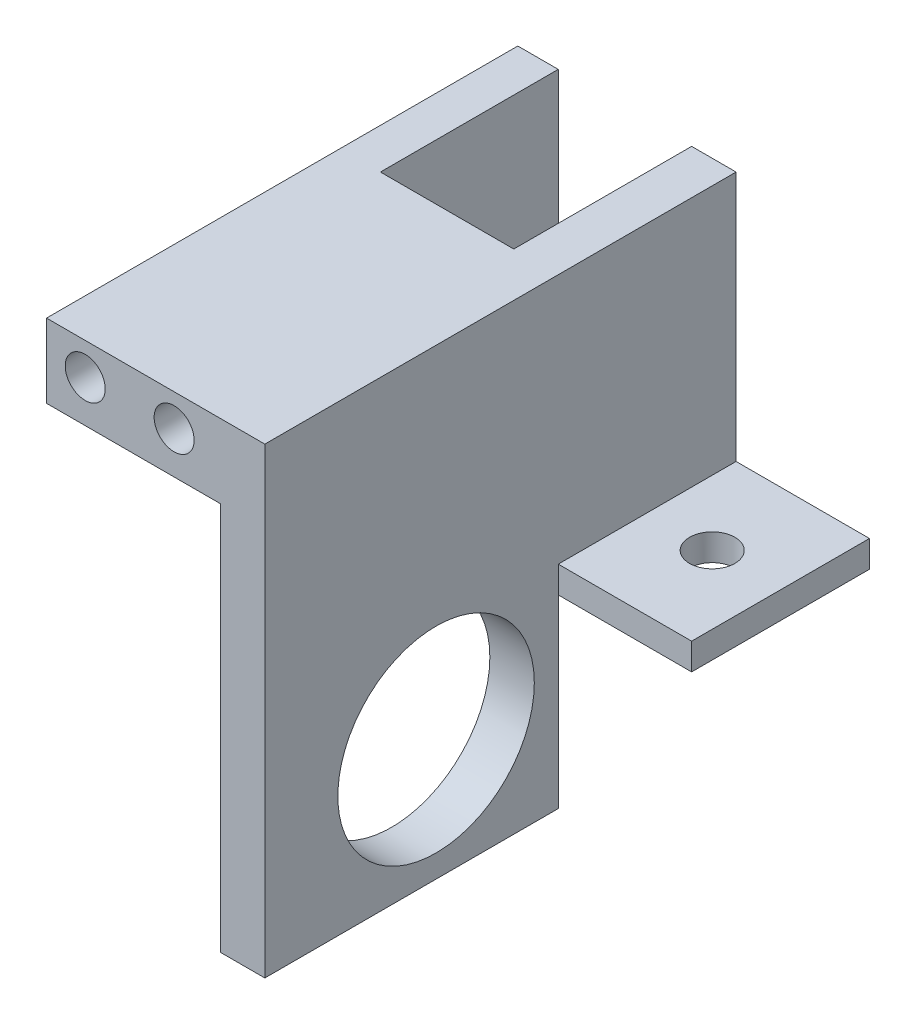
from build123d import *

# Parameters (mm, degrees)
SKETCH_1_W           = 22.333333334
SKETCH_1_H           = 10
EXTRUDE_1_DEPTH      = 30
SKETCH_4_W           = 1.083333334
SKETCH_4_H           = 30
CUT_EXTRUDE_1_DEPTH  = 30
SKETCH_3_R           = 2.25
CUT_EXTRUDE_2_DEPTH  = 15
SKETCH_5_OUTSIDE_W   = 30.87
SKETCH_5_OUTSIDE_H   = 19.62
SKETCH_5_OUTSIDE_W_2 = 18.7
SKETCH_5_OUTSIDE_H_2 = 8.315719237
CUT_EXTRUDE_3_DEPTH  = 30
SKETCH_10_W          = 18.7
SKETCH_10_H          = 8.304405234
EXTRUDE_2_DEPTH      = 18
SKETCH_11_W          = 20
SKETCH_11_H          = 2.687046706
CUT_EXTRUDE_5_DEPTH  = 36.702801011
CUT_EXTRUDE_6_DEPTH  = 32.955789688
SKETCH_13_W          = 18.7
SKETCH_13_H          = 5
EXTRUDE_3_DEPTH      = 5.617358528
SKETCH_15_W          = 18.7
SKETCH_15_H          = 25
CUT_EXTRUDE_7_DEPTH  = 33.535840608
SKETCH_18_W          = 28
SKETCH_18_H          = 8.304405234
EXTRUDE_5_DEPTH      = 0.85
SKETCH_20_W          = 5
SKETCH_20_H          = 28
EXTRUDE_6_DEPTH      = 52
EXTRUDE_7_DEPTH      = 5
SKETCH_22_R          = 10
CUT_EXTRUDE_8_DEPTH  = 63.24117166
EXTRUDE_8_DEPTH      = 20
SKETCH_30_W          = 5
SKETCH_30_H          = 20
CUT_EXTRUDE_10_DEPTH = 20.81
EXTRUDE_9_DEPTH      = 15
EXTRUDE_9_DEPTH_BACK = 20
SKETCH_31_W          = 20
SKETCH_31_H          = 3
SKETCH_32_R          = 2.55
CUT_EXTRUDE_11_DEPTH = 52.125105162
SKETCH_33_W          = 4.55
SKETCH_33_H          = 20
EXTRUDE_10_DEPTH     = 31.19
SKETCH_34_R          = 11.05
CUT_EXTRUDE_12_DEPTH = 10


with BuildPart() as part:
    # 草图1 → 凸台-拉伸1 (new body)
    with BuildSketch(Plane.XY):
        Rectangle(SKETCH_1_W, SKETCH_1_H)
    extrude(amount=EXTRUDE_1_DEPTH)

    # 草图4 → 切除-拉伸1 (cut)
    with BuildSketch(Plane.XZ.offset(5)):
        with Locations((-10.625, 15)):
            Rectangle(SKETCH_4_W, SKETCH_4_H)
    extrude(amount=-CUT_EXTRUDE_1_DEPTH, mode=Mode.SUBTRACT)

    # 草图3 → 切除-拉伸2 (cut)
    with BuildSketch(Plane.XY.offset(30)):
        with Locations((-4.883333333, -0.3)):
            Circle(SKETCH_3_R)
        with Locations((5.116666667, -0.3)):
            Circle(SKETCH_3_R)
    extrude(amount=-CUT_EXTRUDE_2_DEPTH, mode=Mode.SUBTRACT)

    # 草图5 outside → 切除-拉伸3 (cut)
    with BuildSketch(Plane.XY.offset(30)):
        with Locations((0.542, 0)):
            Rectangle(SKETCH_5_OUTSIDE_W, SKETCH_5_OUTSIDE_H)
        with Locations((0.116666667, -0.853454385)):
            Rectangle(SKETCH_5_OUTSIDE_W_2, SKETCH_5_OUTSIDE_H_2, mode=Mode.SUBTRACT)
    extrude(amount=-CUT_EXTRUDE_3_DEPTH, mode=Mode.SUBTRACT)

    # 草图10 → 凸台-拉伸2 (add)
    with BuildSketch(Plane(origin=(0, 0, 0), x_dir=(-1, 0, 0), z_dir=(0, 0, -1))):
        with Locations((-0.116666667, -0.847797383)):
            Rectangle(SKETCH_10_W, SKETCH_10_H)
    extrude(amount=EXTRUDE_2_DEPTH)

    # 草图11 → 切除-拉伸5 (cut, through all)
    with BuildSketch(Plane(origin=(9.466666667, 0, 0), x_dir=(0, 0, -1), z_dir=(1, 0, 0))):
        with Locations((8, -3.656476647)):
            Rectangle(SKETCH_11_W, SKETCH_11_H)
    extrude(amount=-CUT_EXTRUDE_5_DEPTH, mode=Mode.SUBTRACT)

    # 草图12 → 切除-拉伸6 (cut, through all)
    with BuildSketch(Plane.XZ.offset(2.312953294)):
        with BuildLine():
            ThreePointArc((-2.185193673, -12.99813966), (-4.733333333, -10.45), (-7.281472993, -12.99813966))
            Line((-7.281472993, -12.99813966), (-2.185193673, -12.99813966))
        make_face()
        with BuildLine():
            Line((-2.185193673, -12.99813966), (-7.281472993, -12.99813966))
            ThreePointArc((-7.281472993, -12.99813966), (-4.733333333, -15.54627932), (-2.185193673, -12.99813966))
        make_face()
        with BuildLine():
            ThreePointArc((7.514806327, -12.99813966), (4.966666667, -10.45), (2.418527007, -12.99813966))
            Line((2.418527007, -12.99813966), (7.514806327, -12.99813966))
        make_face()
        with BuildLine():
            Line((7.514806327, -12.99813966), (2.418527007, -12.99813966))
            ThreePointArc((2.418527007, -12.99813966), (4.966666667, -15.54627932), (7.514806327, -12.99813966))
        make_face()
    extrude(amount=-CUT_EXTRUDE_6_DEPTH, mode=Mode.SUBTRACT)

    # 草图13 → 凸台-拉伸3 (add)
    with BuildSketch(Plane(origin=(0, 3.304405234, 0), x_dir=(1, 0, 0), z_dir=(0, 1, 0))):
        with Locations((0.116666667, 20.5)):
            Rectangle(SKETCH_13_W, SKETCH_13_H)
    extrude(amount=-EXTRUDE_3_DEPTH)

    # 草图15 → 切除-拉伸7 (cut, through all)
    with BuildSketch(Plane.XZ.offset(5)):
        with Locations((0.116666667, -10.5)):
            Rectangle(SKETCH_15_W, SKETCH_15_H)
    extrude(amount=-CUT_EXTRUDE_7_DEPTH, mode=Mode.SUBTRACT)

    # 草图18 → 凸台-拉伸5 (add)
    with BuildSketch(Plane(origin=(9.466666667, 0, 0), x_dir=(0, 0, -1), z_dir=(1, 0, 0))):
        with Locations((-16, -0.847797383)):
            Rectangle(SKETCH_18_W, SKETCH_18_H)
    extrude(amount=EXTRUDE_5_DEPTH)

    # 草图20 → 凸台-拉伸6 (add)
    with BuildSketch(Plane(origin=(0, 3.304405234, 0), x_dir=(1, 0, 0), z_dir=(0, 1, 0))):
        with Locations((12.816666667, -16)):
            Rectangle(SKETCH_20_W, SKETCH_20_H)
    extrude(amount=-EXTRUDE_6_DEPTH)

    # 草图23 → 凸台-拉伸7 (add)
    with BuildSketch(Plane(origin=(0, 0, 2), x_dir=(-1, 0, 0), z_dir=(0, 0, -1))):
        Polygon((9.233333333, 3.304405234), (-15.316666667, 3.304405234), (-15.316666667, -48.695594766), (-10.316666667, -48.695594766), (-10.316666667, -5), (9.233333333, -5), align=None)
    extrude(amount=EXTRUDE_7_DEPTH)

    # 草图22 → 切除-拉伸8 (cut, through all)
    with BuildSketch(Plane(origin=(15.316666667, 0, 0), x_dir=(0, 0, -1), z_dir=(1, 0, 0))):
        with Locations((-10.741872617, -35.1)):
            Circle(SKETCH_22_R)
    extrude(amount=-CUT_EXTRUDE_8_DEPTH, mode=Mode.SUBTRACT)

    # 草图24 → 凸台-拉伸8 (add)
    with BuildSketch(Plane(origin=(0, 0, -3), x_dir=(-1, 0, 0), z_dir=(0, 0, -1))):
        Polygon((-10.316666667, -5), (-10.316666667, 3.304405234), (-15.316666667, 3.304405234), (-15.316666667, -48.695594766), (-10.316666667, -48.695594766), align=None)
    extrude(amount=EXTRUDE_8_DEPTH)

    # 草图30 → 切除-拉伸10 (cut)
    with BuildSketch(Plane.XZ.offset(48.695594766)):
        with Locations((12.816666667, -13)):
            Rectangle(SKETCH_30_W, SKETCH_30_H)
    extrude(amount=-CUT_EXTRUDE_10_DEPTH, mode=Mode.SUBTRACT)

    # 草图31 → 凸台-拉伸9 (add, two sides: drawn at the far end of the back side and taken through both)
    with BuildSketch(Plane(origin=(15.316666667, 0, 0), x_dir=(0, 0, -1), z_dir=(1, 0, 0)).offset(-EXTRUDE_9_DEPTH_BACK)):
        with Locations((13, -26.385594766)):
            Rectangle(SKETCH_31_W, SKETCH_31_H)
    extrude(amount=EXTRUDE_9_DEPTH + EXTRUDE_9_DEPTH_BACK)

    # 草图32 → 切除-拉伸11 (cut, through all)
    with BuildSketch(Plane(origin=(0, -24.885594766, 0), x_dir=(1, 0, 0), z_dir=(0, 1, 0))):
        with Locations(Location((3.000831302, 13, 0), (0, 0, 270))):
            Circle(SKETCH_32_R)
        with Locations(Location((22.632502032, 13, 0), (0, 0, 270))):
            Circle(SKETCH_32_R)
    extrude(amount=-CUT_EXTRUDE_11_DEPTH, mode=Mode.SUBTRACT)

    # 草图33 → 凸台-拉伸10 (add)
    with BuildSketch(Plane(origin=(0, 3.304405234, 0), x_dir=(1, 0, 0), z_dir=(0, 1, 0))):
        with Locations((-6.958333333, 13)):
            Rectangle(SKETCH_33_W, SKETCH_33_H)
    extrude(amount=-EXTRUDE_10_DEPTH)

    # 草图34 → 切除-拉伸12 (cut)
    with BuildSketch(Plane(origin=(15.316666667, 0, 0), x_dir=(0, 0, -1), z_dir=(1, 0, 0))):
        with Locations((-10.741872617, -35.1)):
            Circle(SKETCH_34_R)
    extrude(amount=-CUT_EXTRUDE_12_DEPTH, mode=Mode.SUBTRACT)


solid = part.part
